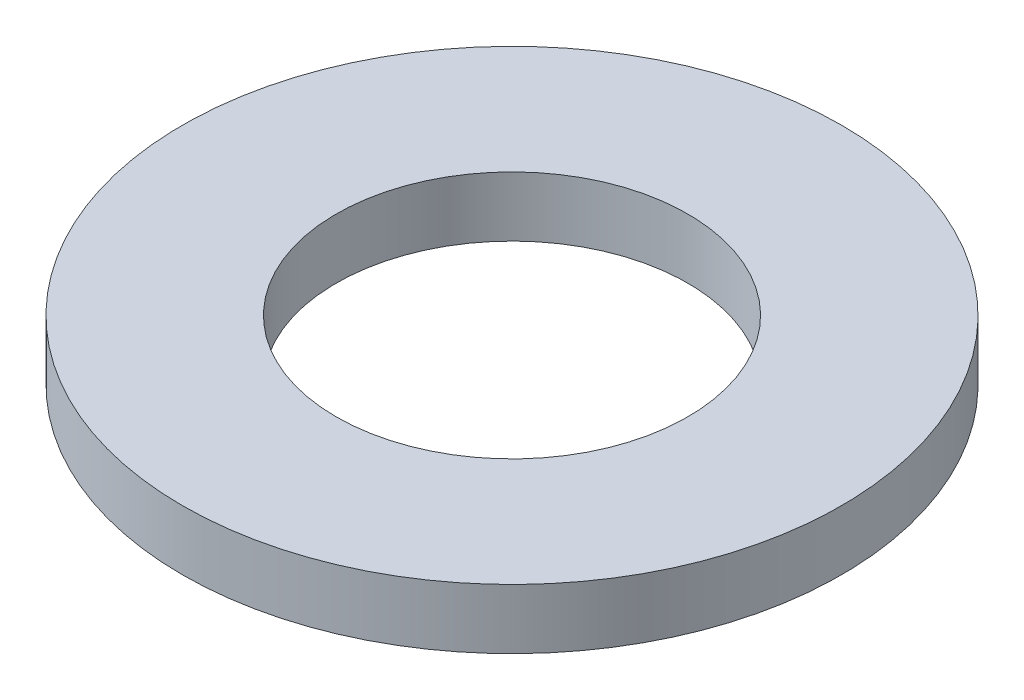
from build123d import *

# Parameters (mm, degrees)
SKETCH1_R           = 8.25
SKETCH1_R_2         = 4.4
BOSS_EXTRUDE1_DEPTH = 1.5


with BuildPart() as part:
    # Sketch1 → Boss-Extrude1 (new body)
    with BuildSketch(Plane(origin=(0, 0, 0), x_dir=(1, 0, 0), z_dir=(0, 1, 0))):
        with Locations(Location((-67.889009298, 0, 0), (0, 0, 270))):
            Circle(SKETCH1_R)
        with Locations(Location((-67.889009298, 0, 0), (0, 0, 270))):
            Circle(SKETCH1_R_2, mode=Mode.SUBTRACT)
    extrude(amount=BOSS_EXTRUDE1_DEPTH)


solid = part.part
